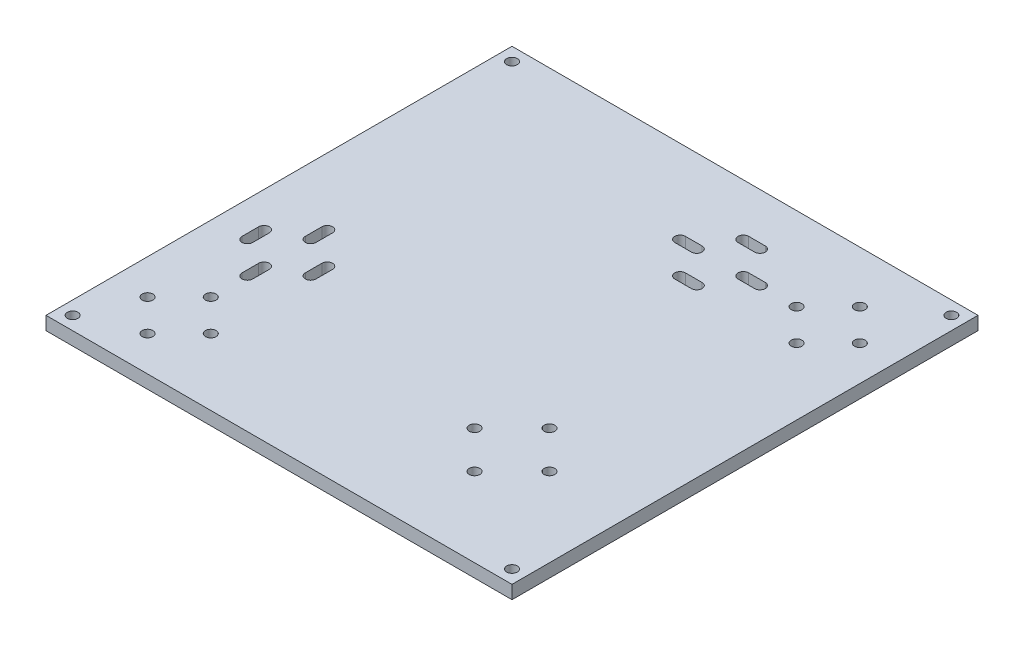
from build123d import *

# Parameters (mm, degrees)
SKETCH1_W           = 140
SKETCH1_H           = 140
BOSS_EXTRUDE1_DEPTH = 4
SKETCH2_R           = 1.6
CUT_EXTRUDE1_DEPTH  = 4
SKETCH3_R           = 1.6
CUT_EXTRUDE2_DEPTH  = 10
CUT_EXTRUDE3_DEPTH  = 10
SKETCH5_R           = 1.6
CUT_EXTRUDE5_DEPTH  = 10


with BuildPart() as part:
    # Sketch1 → Boss-Extrude1 (new body)
    with BuildSketch(Plane(origin=(0, 0, 0), x_dir=(1, 0, 0), z_dir=(0, 1, 0))):
        Rectangle(SKETCH1_W, SKETCH1_H)
    extrude(amount=BOSS_EXTRUDE1_DEPTH)

    # Sketch2 → Cut-Extrude1 (cut)
    with BuildSketch(Plane(origin=(0, 4, 0), x_dir=(1, 0, 0), z_dir=(0, 1, 0))):
        with Locations(Location((29.5, 45, 0), (0, 0, 270))):
            Circle(SKETCH2_R)
        with Locations(Location((59.5, 45, 0), (0, 0, 270))):
            Circle(SKETCH2_R)
        with Locations(Location((-50, -29.5, 0), (0, 0, 270))):
            Circle(SKETCH2_R)
        with Locations(Location((-50, -59.5, 0), (0, 0, 270))):
            Circle(SKETCH2_R)
        with Locations(Location((20, 35.5, 0), (0, 0, 270))):
            Circle(SKETCH2_R)
        with Locations(Location((10.5, 45, 0), (0, 0, 270))):
            Circle(SKETCH2_R)
        with Locations(Location((20, 54.5, 0), (0, 0, 270))):
            Circle(SKETCH2_R)
        with Locations(Location((50, 35.5, 0), (0, 0, 270))):
            Circle(SKETCH2_R)
        with Locations(Location((40.5, 45, 0), (0, 0, 270))):
            Circle(SKETCH2_R)
        with Locations(Location((50, 54.5, 0), (0, 0, 270))):
            Circle(SKETCH2_R)
        with Locations(Location((-59.5, -50, 0), (0, 0, 270))):
            Circle(SKETCH2_R)
        with Locations(Location((-50, -40.5, 0), (0, 0, 270))):
            Circle(SKETCH2_R)
        with Locations(Location((-40.5, -50, 0), (0, 0, 270))):
            Circle(SKETCH2_R)
        with Locations(Location((-59.5, -20, 0), (0, 0, 270))):
            Circle(SKETCH2_R)
        with Locations(Location((-50, -10.5, 0), (0, 0, 270))):
            Circle(SKETCH2_R)
        with Locations(Location((-40.5, -20, 0), (0, 0, 270))):
            Circle(SKETCH2_R)
    extrude(amount=-CUT_EXTRUDE1_DEPTH, mode=Mode.SUBTRACT)

    # Sketch3 → Cut-Extrude2 (cut)
    with BuildSketch(Plane(origin=(0, 4, 0), x_dir=(1, 0, 0), z_dir=(0, 1, 0))):
        with Locations(Location((35, -23.75, 0), (0, 0, 270))):
            Circle(SKETCH3_R)
        with Locations(Location((46.25, -35, 0), (0, 0, 270))):
            Circle(SKETCH3_R)
        with Locations(Location((35, -46.25, 0), (0, 0, 270))):
            Circle(SKETCH3_R)
        with Locations(Location((23.75, -35, 0), (0, 0, 270))):
            Circle(SKETCH3_R)
    extrude(amount=-CUT_EXTRUDE2_DEPTH, mode=Mode.SUBTRACT)

    # Sketch4 → Cut-Extrude3 (cut)
    with BuildSketch(Plane(origin=(0, 4, 0), x_dir=(1, 0, 0), z_dir=(0, 1, 0))):
        with BuildLine():
            Line((-51.6, -29.5), (-51.6, -24.5))
            ThreePointArc((-51.6, -24.5), (-50, -22.9), (-48.4, -24.5))
            Line((-48.4, -24.5), (-48.4, -29.5))
            ThreePointArc((-48.4, -29.5), (-50, -31.1), (-51.6, -29.5))
        make_face()
        with BuildLine():
            Line((-42.1, -20), (-42.1, -15))
            ThreePointArc((-42.1, -15), (-40.5, -13.4), (-38.9, -15))
            Line((-38.9, -15), (-38.9, -20))
            ThreePointArc((-38.9, -20), (-40.5, -21.6), (-42.1, -20))
        make_face()
        with BuildLine():
            Line((-51.6, -10.5), (-51.6, -5.5))
            ThreePointArc((-51.6, -5.5), (-50, -3.9), (-48.4, -5.5))
            Line((-48.4, -5.5), (-48.4, -10.5))
            ThreePointArc((-48.4, -10.5), (-50, -12.1), (-51.6, -10.5))
        make_face()
        with BuildLine():
            Line((-61.1, -20), (-61.1, -15))
            ThreePointArc((-61.1, -15), (-59.5, -13.4), (-57.9, -15))
            Line((-57.9, -15), (-57.9, -20))
            ThreePointArc((-57.9, -20), (-59.5, -21.6), (-61.1, -20))
        make_face()
        with BuildLine():
            Line((10.5, 43.4), (5.5, 43.4))
            ThreePointArc((5.5, 43.4), (3.9, 45), (5.5, 46.6))
            Line((5.5, 46.6), (10.5, 46.6))
            ThreePointArc((10.5, 46.6), (12.1, 45), (10.5, 43.4))
        make_face()
        with BuildLine():
            Line((20, 52.9), (15, 52.9))
            ThreePointArc((15, 52.9), (13.4, 54.5), (15, 56.1))
            Line((15, 56.1), (20, 56.1))
            ThreePointArc((20, 56.1), (21.6, 54.5), (20, 52.9))
        make_face()
        with BuildLine():
            Line((29.5, 43.4), (24.5, 43.4))
            ThreePointArc((24.5, 43.4), (22.9, 45), (24.5, 46.6))
            Line((24.5, 46.6), (29.5, 46.6))
            ThreePointArc((29.5, 46.6), (31.1, 45), (29.5, 43.4))
        make_face()
        with BuildLine():
            Line((20, 33.9), (15, 33.9))
            ThreePointArc((15, 33.9), (13.4, 35.5), (15, 37.1))
            Line((15, 37.1), (20, 37.1))
            ThreePointArc((20, 37.1), (21.6, 35.5), (20, 33.9))
        make_face()
    extrude(amount=-CUT_EXTRUDE3_DEPTH, mode=Mode.SUBTRACT)

    # Sketch5 → Cut-Extrude5 (cut)
    with BuildSketch(Plane(origin=(0, 4, 0), x_dir=(1, 0, 0), z_dir=(0, 1, 0))):
        with Locations(Location((-66, 66, 0), (0, 0, 270))):
            Circle(SKETCH5_R)
        with Locations(Location((66, 66, 0), (0, 0, 270))):
            Circle(SKETCH5_R)
        with Locations(Location((66, -66, 0), (0, 0, 270))):
            Circle(SKETCH5_R)
        with Locations(Location((-66, -66, 0), (0, 0, 270))):
            Circle(SKETCH5_R)
    extrude(amount=-CUT_EXTRUDE5_DEPTH, mode=Mode.SUBTRACT)


solid = part.part
